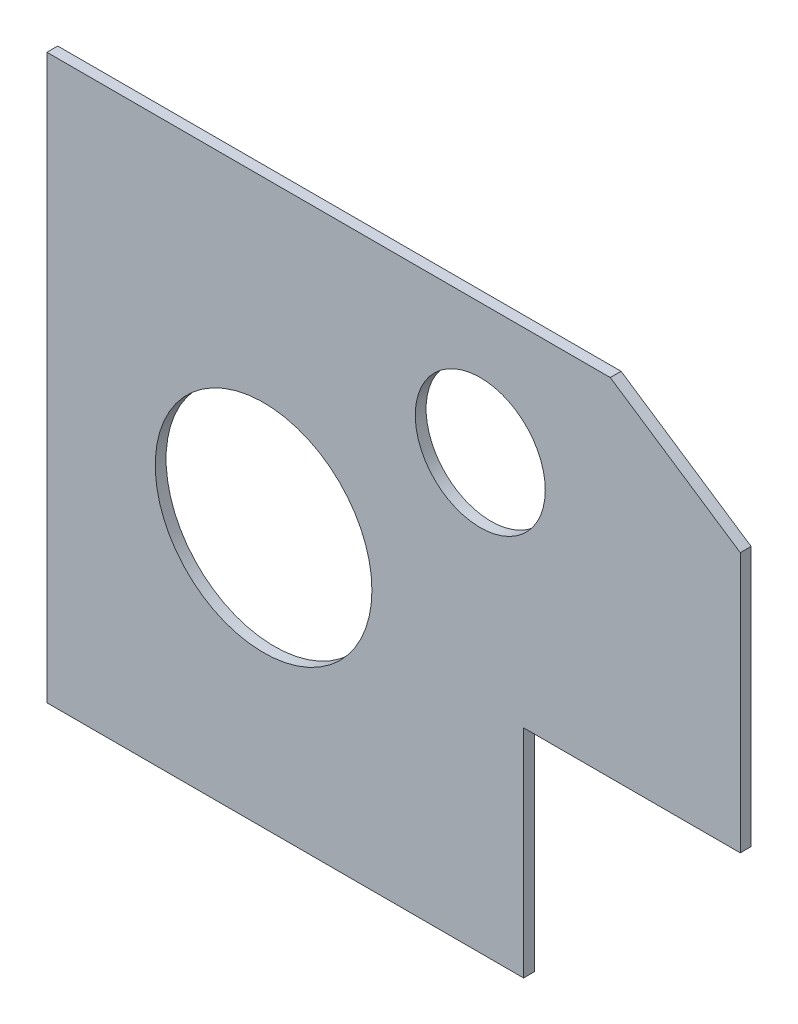
from build123d import *

# Parameters (mm, degrees)
SKETCH2_W               = 203.2
SKETCH2_H               = 165.1
BOSS_EXTRUDE1_DEPTH     = 3.175
CUT_EXTRUDE1_REACH      = 263.836
SKETCH6_W               = 63.5
SKETCH6_H               = 63.5
CUT_EXTRUDE3_DEPTH      = 262.836457784
CUT_EXTRUDE3_DEPTH_BACK = 262.836457784
SKETCH13_R              = 19.05
SKETCH13_R_2            = 31.75
CUT_EXTRUDE4_DEPTH      = 262.836457784


with BuildPart() as part:
    # Sketch2 → Boss-Extrude1 (new body)
    with BuildSketch(Plane.XY):
        with Locations((101.6, 82.55)):
            Rectangle(SKETCH2_W, SKETCH2_H)
    extrude(amount=BOSS_EXTRUDE1_DEPTH)

    # Sketch6 → Cut-Extrude1 (cut, up to next)
    with BuildSketch(Plane(origin=(0, 0, 0), x_dir=(-1, 0, 0), z_dir=(0, 0, -1)), mode=Mode.PRIVATE) as cut_extrude1_sk1:
        with Locations((-171.45, 31.75)):
            Rectangle(SKETCH6_W, SKETCH6_H)
    cut_extrude1_tool1 = extrude(cut_extrude1_sk1.sketch, amount=-CUT_EXTRUDE1_REACH, mode=Mode.PRIVATE) & part.part
    add(cut_extrude1_tool1.solids().sort_by_distance((171.45, 31.75, 0))[0], mode=Mode.SUBTRACT)

    # Sketch7 → Cut-Extrude3 (cut, two sides: drawn at the far end of the back side and taken through both)
    with BuildSketch(Plane.XY.offset(3.175).offset(-CUT_EXTRUDE3_DEPTH_BACK)):
        Polygon((-253.570061247, 444.213374165), (165.1, 165.1), (203.2, 139.7), (621.870061247, -139.413374165), (1180.096809576, 697.926748329), (304.656687082, 1281.553496659), align=None)
    extrude(amount=CUT_EXTRUDE3_DEPTH + CUT_EXTRUDE3_DEPTH_BACK, mode=Mode.SUBTRACT)

    # Sketch13 → Cut-Extrude4 (cut, through all)
    with BuildSketch(Plane.XY.offset(3.175)):
        with Locations((127, 127)):
            Circle(SKETCH13_R)
        with Locations((63.5, 76.2)):
            Circle(SKETCH13_R_2)
    extrude(amount=-CUT_EXTRUDE4_DEPTH, mode=Mode.SUBTRACT)


solid = part.part
